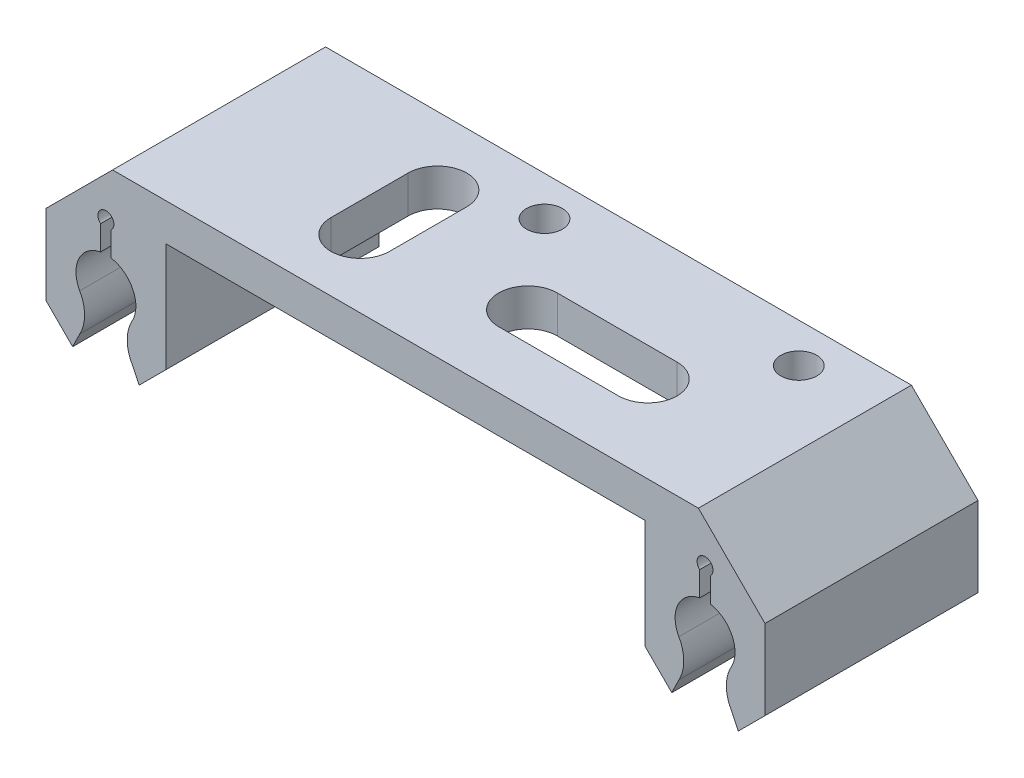
from build123d import *

# Parameters (mm, degrees)
BOSS_EXTRUDE1_DEPTH = 16
CHAMFER1_SIZE       = 2
SKETCH2_R           = 2.25
CUT_EXTRUDE1_DEPTH  = 16
CUT_EXTRUDE2_DEPTH  = 16
SKETCH5_R           = 1.35
CUT_EXTRUDE3_DEPTH  = 16
CHAMFER3_SIZE       = 5


with BuildPart() as part:
    # Sketch1 → Boss-Extrude1 (new body)
    with BuildSketch(Plane.XY):
        Polygon((0, 0), (0, 13), (54, 13), (54, 0), (45, 0), (45, 10.2), (9, 10.2), (9, 0), align=None)
    extrude(amount=BOSS_EXTRUDE1_DEPTH)

    # Chamfer1
    chamfer1_edges = [part.edges().sort_by_distance(p)[0] for p in [
        (0, 0, 8),
        (54, 0, 8),
        (45, 0, 8),
        (9, 0, 8),
    ]]
    chamfer(chamfer1_edges, length=CHAMFER1_SIZE)

    # Sketch2 → Cut-Extrude1 (cut)
    with BuildSketch(Plane.XY.offset(16)):
        with Locations((4.5, 5)):
            Circle(SKETCH2_R)
        with Locations((49.5, 5)):
            Circle(SKETCH2_R)
    extrude(amount=-CUT_EXTRUDE1_DEPTH, mode=Mode.SUBTRACT)

    # Sketch3 → Cut-Extrude2 (cut)
    with BuildSketch(Plane.XY.offset(16)):
        with BuildLine():
            Line((2.534938179, 3.904083927), (6.465061821, 3.904083927))
            ThreePointArc((6.465061821, 3.904083927), (6.1, 2.5), (6.465061821, 1.095916073))
            Line((6.465061821, 1.095916073), (7, 0))
            Line((7, 0), (2, 0))
            Line((2, 0), (2.534938179, 1.095916073))
            ThreePointArc((2.534938179, 1.095916073), (2.9, 2.5), (2.534938179, 3.904083927))
        make_face()
        with BuildLine():
            Line((4.1, 9.052786405), (4.1, 6.794596967))
            Line((4.1, 6.794596967), (4.9, 6.794596967))
            Line((4.9, 6.794596967), (4.9, 9.052786405))
            ThreePointArc((4.9, 9.052786405), (4.5, 10.1), (4.1, 9.052786405))
        make_face()
    cut_extrude2 = extrude(amount=-CUT_EXTRUDE2_DEPTH, mode=Mode.SUBTRACT)

    # Mirror1: Cut-Extrude2 across plane
    add(cut_extrude2.mirror(Plane(origin=(27, 0, 0), x_dir=(0, 0, 1), z_dir=(1, 0, 0))), mode=Mode.SUBTRACT)

    # Sketch5 → Cut-Extrude3 (cut)
    with BuildSketch(Plane(origin=(0, 13, 0), x_dir=(1, 0, 0), z_dir=(0, 1, 0))):
        with Locations(Location((24.4, -2.96, 0), (0, 0, 270))):
            Circle(SKETCH5_R)
        with Locations(Location((43.5, -2.96, 0), (0, 0, 270))):
            Circle(SKETCH5_R)
        with BuildLine():
            Line((20.7, -5.1), (20.7, -10.9))
            ThreePointArc((20.7, -10.9), (18.5, -13.1), (16.3, -10.9))
            Line((16.3, -10.9), (16.3, -5.1))
            ThreePointArc((16.3, -5.1), (18.5, -2.9), (20.7, -5.1))
        make_face()
        with BuildLine():
            Line((29.7, -7.3), (38.7, -7.3))
            ThreePointArc((38.7, -7.3), (40.9, -9.5), (38.7, -11.7))
            Line((38.7, -11.7), (29.7, -11.7))
            ThreePointArc((29.7, -11.7), (27.5, -9.5), (29.7, -7.3))
        make_face()
    extrude(amount=-CUT_EXTRUDE3_DEPTH, mode=Mode.SUBTRACT)

    # Chamfer3
    chamfer3_edges = [part.edges().sort_by_distance(p)[0] for p in [
        (0, 13, 8),
        (54, 13, 8),
    ]]
    chamfer(chamfer3_edges, length=CHAMFER3_SIZE)


solid = part.part
